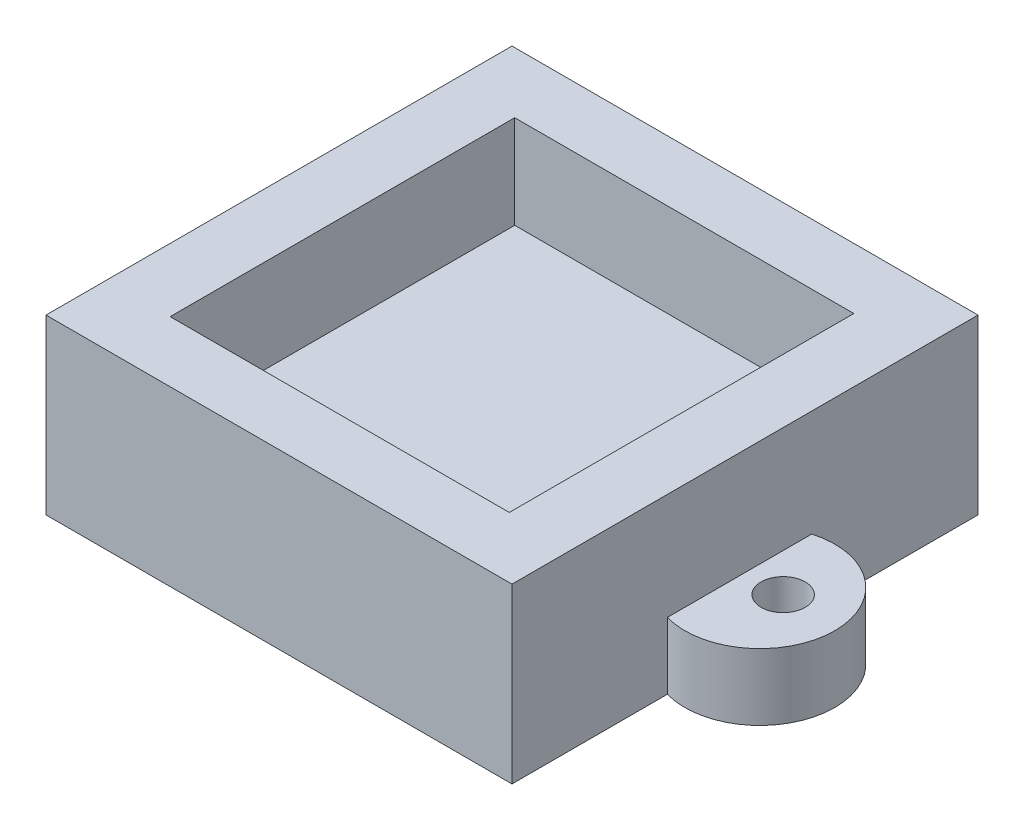
from build123d import *

# Parameters (mm, degrees)
SKETCH1_W           = 35
SKETCH1_H           = 35
BOSS_EXTRUDE1_DEPTH = 13
SKETCH2_W           = 25.47118856
SKETCH2_H           = 25.879985414
CUT_EXTRUDE1_DEPTH  = 7
BOSS_EXTRUDE2_DEPTH = 5
SKETCH5_R           = 1.659140746
CUT_EXTRUDE2_DEPTH  = 33.909124542


with BuildPart() as part:
    # Sketch1 → Boss-Extrude1 (new body)
    with BuildSketch(Plane(origin=(0, 0, 0), x_dir=(1, 0, 0), z_dir=(0, 1, 0))):
        Rectangle(SKETCH1_W, SKETCH1_H)
    extrude(amount=BOSS_EXTRUDE1_DEPTH)

    # Sketch2 → Cut-Extrude1 (cut)
    with BuildSketch(Plane(origin=(0, 13, 0), x_dir=(1, 0, 0), z_dir=(0, 1, 0))):
        Rectangle(SKETCH2_W, SKETCH2_H)
    extrude(amount=-CUT_EXTRUDE1_DEPTH, mode=Mode.SUBTRACT)

    # Sketch3 → Boss-Extrude2 (add)
    with BuildSketch(Plane.XZ):
        with BuildLine():
            Line((-17.5, -5.015622933), (-17.5, 5.83321664))
            ThreePointArc((-17.5, 5.83321664), (-24.652798585, 0.408796853), (-17.5, -5.015622933))
        make_face()
        with BuildLine():
            ThreePointArc((17.5, -5.015622933), (24.652798585, 0.408796853), (17.5, 5.83321664))
            Line((17.5, 5.83321664), (17.5, -5.015622933))
        make_face()
    extrude(amount=-BOSS_EXTRUDE2_DEPTH)

    # Sketch5 → Cut-Extrude2 (cut, through all)
    with BuildSketch(Plane.XZ):
        with Locations(Location((-20.367399271, 0, 0), (0, 0, 270))):
            Circle(SKETCH5_R)
        with Locations(Location((20.367399271, 0, 0), (0, 0, 270))):
            Circle(SKETCH5_R)
    extrude(amount=-CUT_EXTRUDE2_DEPTH, mode=Mode.SUBTRACT)


solid = part.part
